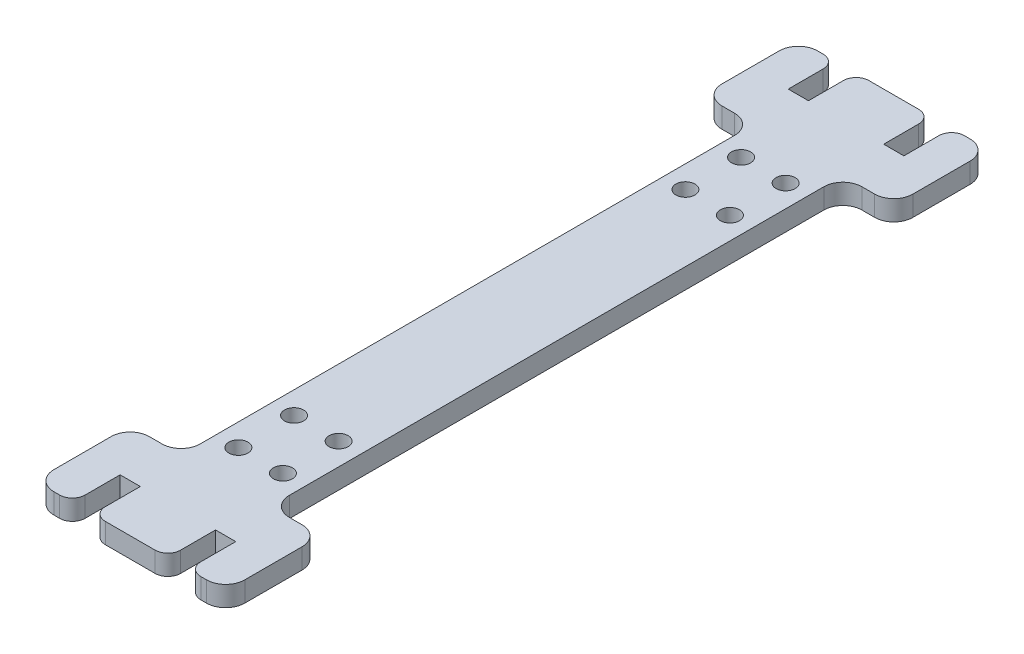
from build123d import *

# Parameters (mm, degrees)
BOSS_EXTRUDE1_DEPTH = 3.175
SKETCH2_W           = 3.175
SKETCH2_H           = 15
CUT_EXTRUDE1_DEPTH  = 62.928027782
SKETCH5_R           = 1.5
CUT_EXTRUDE2_DEPTH  = 10
FILLET1_R           = 2
FILLET2_R           = 3


with BuildPart() as part:
    # Sketch1 → Boss-Extrude1 (new body)
    with BuildSketch(Plane(origin=(0, 0, 0), x_dir=(1, 0, 0), z_dir=(0, 1, 0))):
        Polygon((-15, 60), (15, 60), (15, 45), (7, 45), (7, -45), (15, -45), (15, -60), (-15, -60), (-15, -45), (-7, -45), (-7, 45), (-15, 45), align=None)
    extrude(amount=BOSS_EXTRUDE1_DEPTH)

    # Sketch2 → Cut-Extrude1 (cut, through all)
    with BuildSketch(Plane(origin=(0, 3.175, 0), x_dir=(1, 0, 0), z_dir=(0, 1, 0))):
        with Locations((7.5, 60)):
            Rectangle(SKETCH2_W, SKETCH2_H)
        with Locations((-7.5, 60)):
            Rectangle(SKETCH2_W, SKETCH2_H)
        with Locations((7.5, -60)):
            Rectangle(SKETCH2_W, SKETCH2_H)
        with Locations((-7.5, -60)):
            Rectangle(SKETCH2_W, SKETCH2_H)
    extrude(amount=-CUT_EXTRUDE1_DEPTH, mode=Mode.SUBTRACT)

    # Sketch5 → Cut-Extrude2 (cut)
    with BuildSketch(Plane.XZ):
        with Locations(Location((3.5, -39.5, 0), (0, 0, 270))):
            Circle(SKETCH5_R)
        with Locations(Location((-3.5, -39.5, 0), (0, 0, 270))):
            Circle(SKETCH5_R)
        with Locations(Location((-3.5, -30.75, 0), (0, 0, 270))):
            Circle(SKETCH5_R)
        with Locations(Location((3.5, 30.75, 0), (0, 0, 270))):
            Circle(SKETCH5_R)
        with Locations(Location((-3.5, 30.75, 0), (0, 0, 270))):
            Circle(SKETCH5_R)
        with Locations(Location((3.5, 39.5, 0), (0, 0, 270))):
            Circle(SKETCH5_R)
        with Locations(Location((-3.5, 39.5, 0), (0, 0, 270))):
            Circle(SKETCH5_R)
        with Locations(Location((3.5, -30.75, 0), (0, 0, 270))):
            Circle(SKETCH5_R)
    extrude(amount=-CUT_EXTRUDE2_DEPTH, mode=Mode.SUBTRACT)

    # Fillet1
    fillet1_edges = [part.edges().sort_by_distance(p)[0] for p in [
        (-5.9125, 1.5875, -60),
        (-9.0875, 1.5875, -60),
        (5.9125, 1.5875, 60),
        (9.0875, 1.5875, 60),
        (-5.9125, 1.5875, 60),
        (-9.0875, 1.5875, 60),
        (9.0875, 1.5875, -60),
        (5.9125, 1.5875, -60),
    ]]
    fillet(fillet1_edges, radius=FILLET1_R)

    # Fillet2
    fillet2_edges = [part.edges().sort_by_distance(p)[0] for p in [
        (7, 1.5875, -45),
        (7, 1.5875, 45),
        (15, 1.5875, 45),
        (15, 1.5875, 60),
        (-15, 1.5875, 60),
        (-15, 1.5875, 45),
        (-7, 1.5875, 45),
        (-7, 1.5875, -45),
        (-15, 1.5875, -45),
        (-15, 1.5875, -60),
        (15, 1.5875, -60),
        (15, 1.5875, -45),
    ]]
    fillet(fillet2_edges, radius=FILLET2_R)


solid = part.part
